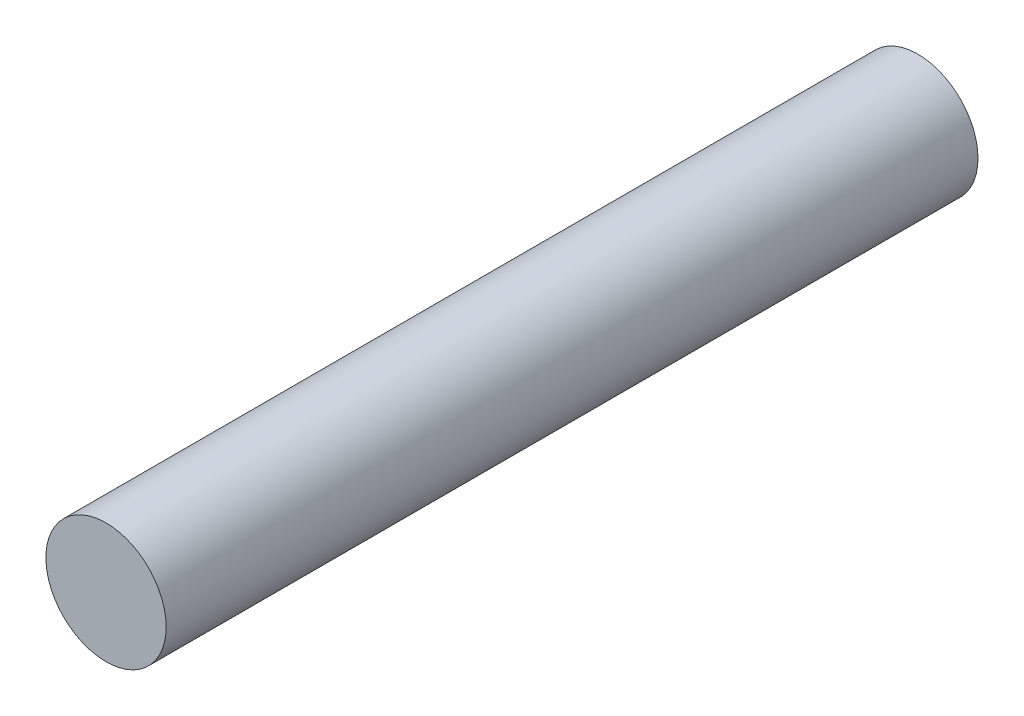
from build123d import *

# Parameters (mm, degrees)
SKETCH1_R           = 2
BOSS_EXTRUDE1_DEPTH = 27


with BuildPart() as part:
    # Sketch1 → Boss-Extrude1 (new body)
    with BuildSketch(Plane.XY):
        Circle(SKETCH1_R)
    extrude(amount=BOSS_EXTRUDE1_DEPTH)


solid = part.part
